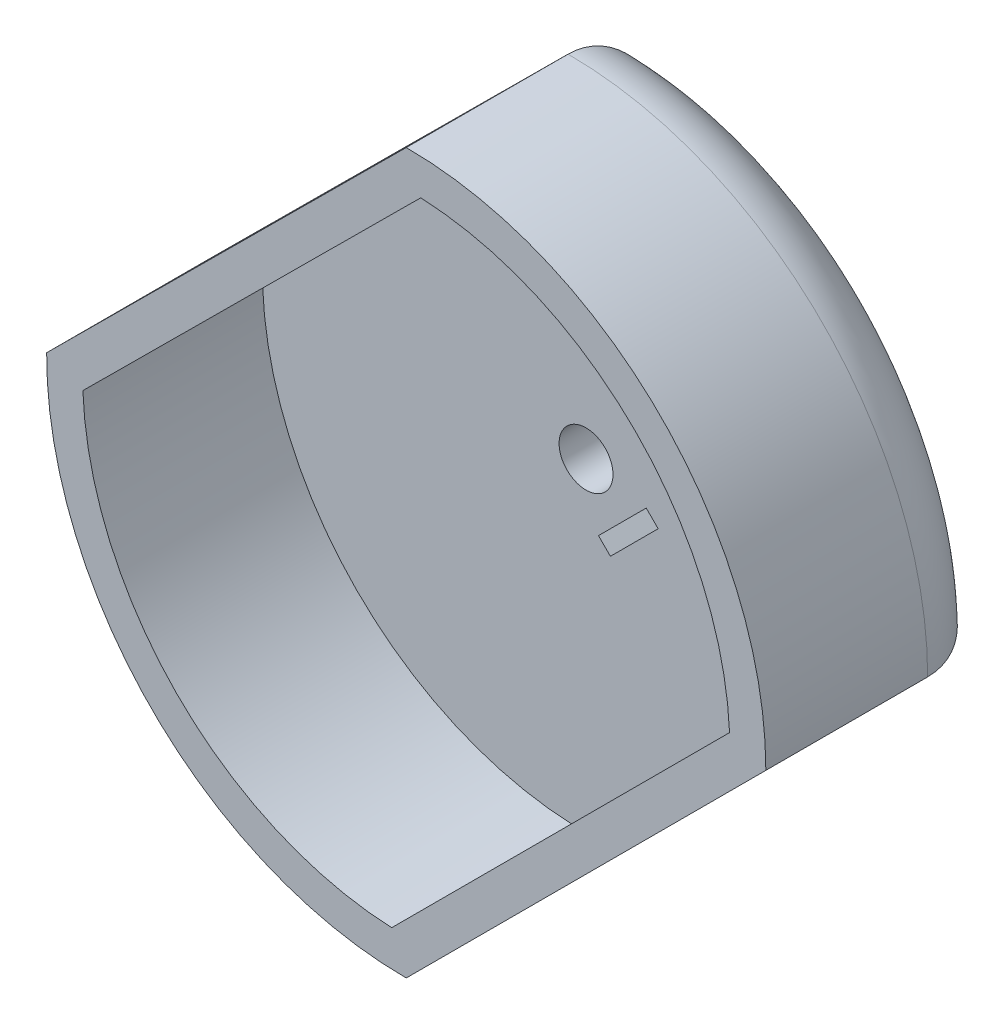
from build123d import *

# Parameters (mm, degrees)
BOSS_EXTRUDE1_DEPTH = 5
BOSS_EXTRUDE2_START = 1.5
BOSS_EXTRUDE2_DEPTH = 1.5
FILLET1_R           = 2
BOSS_EXTRUDE3_DEPTH = 1.5
SKETCH4_R           = 0.75
CUT_EXTRUDE1_DEPTH  = 17.248076932
SKETCH5_W           = 1.787924943
SKETCH5_H           = 0.660460042
CUT_EXTRUDE2_DEPTH  = 1
FILLET2_R           = 0.5


with BuildPart() as part:
    # Sketch1 → Boss-Extrude1 (new body)
    with BuildSketch(Plane.XY):
        with BuildLine():
            Line((0, 10), (-9.999822986, 0.0595))
            ThreePointArc((-9.999822986, 0.0595), (-7.09207304, -7.05), (0, -10))
            Line((0, -10), (10, 0))
            ThreePointArc((10, 0), (7.071067812, 7.071067812), (0, 10))
        make_face()
        with BuildLine():
            Line((0.403373919, 8.990955983), (-8.993196905, -0.349870591))
            ThreePointArc((-8.993196905, -0.349870591), (-6.383472043, -6.344390016), (-0.405092287, -8.990878725))
            Line((-0.405092287, -8.990878725), (8.990878725, 0.405092287))
            ThreePointArc((8.990878725, 0.405092287), (6.363352853, 6.36456915), (0.403373919, 8.990955983))
        make_face(mode=Mode.SUBTRACT)
    extrude(amount=BOSS_EXTRUDE1_DEPTH)

    # Sketch2 → Boss-Extrude2 (add)
    with BuildSketch(Plane(origin=(0, 0, 0), x_dir=(-1, 0, 0), z_dir=(0, 0, -1)).offset(BOSS_EXTRUDE2_START)):
        with BuildLine():
            Line((0, 10), (9.999822986, 0.0595))
            ThreePointArc((9.999822986, 0.0595), (7.09207304, -7.05), (0, -10))
            Line((0, -10), (-10, 0))
            ThreePointArc((-10, 0), (-7.071067812, 7.071067812), (0, 10))
        make_face()
    extrude(amount=-BOSS_EXTRUDE2_DEPTH)

    # Fillet1
    fillet1_edges = [part.edges().sort_by_distance(p)[0] for p in [
        (7.071067812, 7.071067812, -1.5),
        (5, -5, -1.5),
        (-7.09207304, -7.05, -1.5),
        (-4.999911493, 5.02975, -1.5),
    ]]
    fillet(fillet1_edges, radius=FILLET1_R)

    # Sketch3 → Boss-Extrude3 (add)
    with BuildSketch(Plane(origin=(0, 0, -1.5), x_dir=(-1, 0, 0), z_dir=(0, 0, -1))):
        with BuildLine():
            Line((0, 2.854684063), (2.854684063, 0))
            ThreePointArc((2.854684063, 0), (-2.018566459, -2.018566459), (0, 2.854684063))
        make_face()
    extrude(amount=BOSS_EXTRUDE3_DEPTH)

    # Sketch4 → Cut-Extrude1 (cut, through all)
    with BuildSketch(Plane(origin=(0, 0, -3), x_dir=(-1, 0, 0), z_dir=(0, 0, -1))):
        Circle(SKETCH4_R)
        Polygon((-1.673451771, -0.345114688), (-0.345114688, -1.673451771), (-0.677198959, -2.005536042), (-2.005536042, -0.677198959), align=None)
    extrude(amount=-CUT_EXTRUDE1_DEPTH, mode=Mode.SUBTRACT)

    # Sketch5 → Cut-Extrude2 (cut)
    with BuildSketch(Plane(origin=(5, -5, 0), x_dir=(0, 0, -1), z_dir=(0.7071067811865477, -0.7071067811865475, 0))):
        with Locations((-2.538538979, -2.770235161)):
            Rectangle(SKETCH5_W, SKETCH5_H)
        with Locations((-2.538538979, 2.770235161)):
            Rectangle(SKETCH5_W, SKETCH5_H)
    extrude(amount=-CUT_EXTRUDE2_DEPTH, mode=Mode.SUBTRACT)

    # Fillet2
    fillet2_edges = [part.edges().sort_by_distance(p)[0] for p in [
        (2.018566459, -2.018566459, -3),
        (-1.427342031, 1.427342031, -3),
    ]]
    fillet(fillet2_edges, radius=FILLET2_R)


solid = part.part
